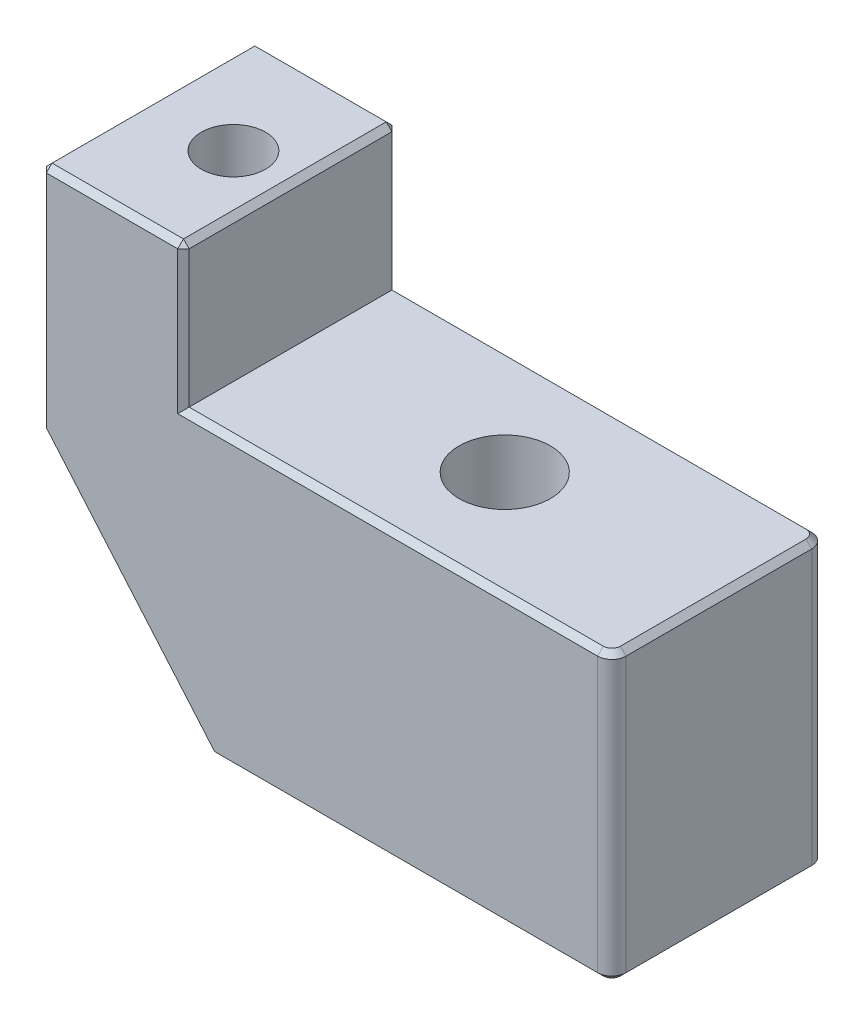
from build123d import *

# Parameters (mm, degrees)
BOSS_EXTRUDE1_DEPTH                                 = 7.5
CBORE_FOR_M6_HEX_SOCKET_HEAD_CAP_SCREW1_D           = 6.4
CBORE_FOR_M6_HEX_SOCKET_HEAD_CAP_SCREW1_CBORE_D     = 11
CBORE_FOR_M6_HEX_SOCKET_HEAD_CAP_SCREW1_CBORE_DEPTH = 6.4
TAP_DRILL_FOR_M4_TAP1_D                             = 3.3
CBORE_FOR_M4_HEX_SOCKET_HEAD_CAP_SCREW1_D           = 4.5
CBORE_FOR_M4_HEX_SOCKET_HEAD_CAP_SCREW1_DEPTH       = 30
CBORE_FOR_M4_HEX_SOCKET_HEAD_CAP_SCREW1_CBORE_D     = 8
CBORE_FOR_M4_HEX_SOCKET_HEAD_CAP_SCREW1_CBORE_DEPTH = 16.4
FILLET1_R                                           = 1
CHAMFER1_SIZE                                       = 0.4


with BuildPart() as part:
    # Sketch1 → Boss-Extrude1 (new, symmetric)
    with BuildSketch(Plane.XY):
        Polygon((0, 0), (0, 16), (10, 16), (10, 6), (40, 6), (40, 0), (40, -14), (12, -14), align=None)
    extrude(amount=BOSS_EXTRUDE1_DEPTH, both=True)

    # CBORE for M6 Hex Socket Head Cap Screw1 (through all)
    with Locations(Plane(origin=(0, -14, 0), x_dir=(-1, 0, 0), z_dir=(0, -1, 0))):
        with Locations((-25, 0)):
            CounterBoreHole(CBORE_FOR_M6_HEX_SOCKET_HEAD_CAP_SCREW1_D / 2, CBORE_FOR_M6_HEX_SOCKET_HEAD_CAP_SCREW1_CBORE_D / 2, CBORE_FOR_M6_HEX_SOCKET_HEAD_CAP_SCREW1_CBORE_DEPTH)

    # Tap Drill for M4 Tap1 (through all)
    with Locations(Plane(origin=(16, 16, 0), x_dir=(0, 0, 1), z_dir=(0, 1, 0))):
        with Locations((0, -10)):
            Hole(TAP_DRILL_FOR_M4_TAP1_D / 2)

    # CBORE for M4 Hex Socket Head Cap Screw1
    with Locations(Plane(origin=(0, -14, 0), x_dir=(-1, 0, 0), z_dir=(0, -1, 0))):
        with Locations((-6, 0)):
            CounterBoreHole(CBORE_FOR_M4_HEX_SOCKET_HEAD_CAP_SCREW1_D / 2, CBORE_FOR_M4_HEX_SOCKET_HEAD_CAP_SCREW1_CBORE_D / 2, CBORE_FOR_M4_HEX_SOCKET_HEAD_CAP_SCREW1_CBORE_DEPTH, depth=CBORE_FOR_M4_HEX_SOCKET_HEAD_CAP_SCREW1_DEPTH)

    # Fillet1
    fillet1_edges = [part.edges().sort_by_distance(p)[0] for p in [
        (40, -4, -7.5),
        (40, -4, 7.5),
    ]]
    fillet(fillet1_edges, radius=FILLET1_R)

    # Chamfer1
    chamfer1_edges = [part.edges().sort_by_distance(p)[0] for p in [
        (25.5, -14, -7.5),
        (6, -7, -7.5),
        (0, 16, 0),
        (10, 16, 0),
        (10, 11, 7.5),
        (5, 16, 7.5),
        (0, 8, 7.5),
        (6, -7, 7.5),
        (40, 6, 0),
        (40, -14, 0),
        (24.5, 6, -7.5),
        (24.5, 6, 7.5),
        (39.707106781, 6, 7.207106781),
        (39.707106781, 6, -7.207106781),
        (39.707106781, -14, 7.207106781),
        (39.707106781, -14, -7.207106781),
        (0, 8, -7.5),
        (25.5, -14, 7.5),
        (5, 16, -7.5),
        (10, 11, -7.5),
    ]]
    chamfer(chamfer1_edges, length=CHAMFER1_SIZE)


solid = part.part
